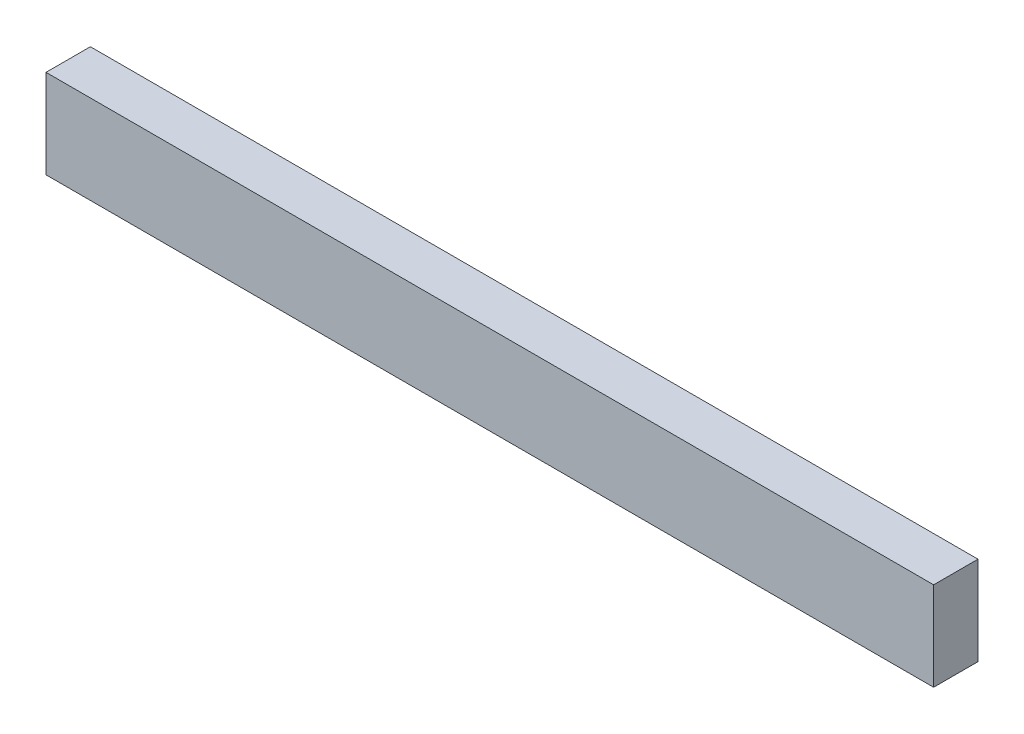
from build123d import *

# Parameters (mm, degrees)
SKETCH_1_W      = 20
SKETCH_1_H      = 2
EXTRUDE_1_DEPTH = 1


with BuildPart() as part:
    # Эскиз1 → Бобышка-Вытянуть1 (new body)
    with BuildSketch(Plane.XY):
        Rectangle(SKETCH_1_W, SKETCH_1_H)
    extrude(amount=EXTRUDE_1_DEPTH)


solid = part.part
